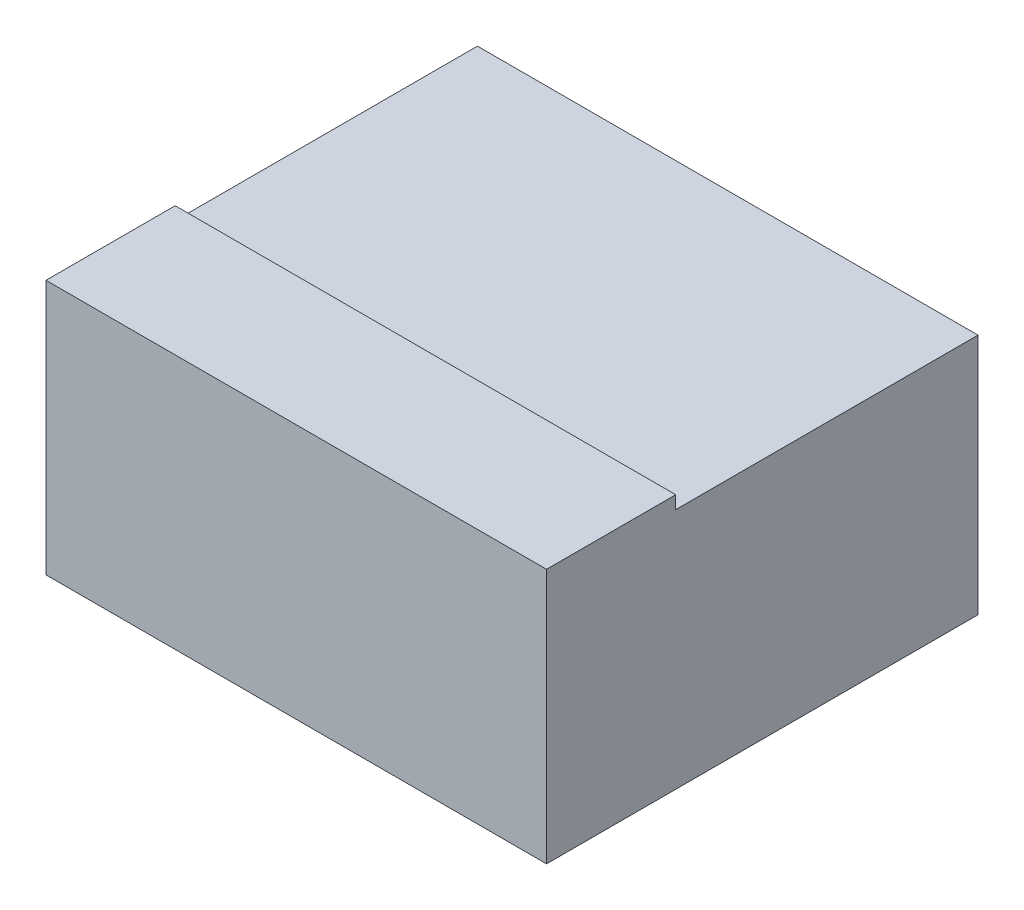
from build123d import *

# Parameters (mm, degrees)
SKETCH1_W           = 77.5
SKETCH1_H           = 66.8
BOSS_EXTRUDE1_DEPTH = 37.5
SKETCH3_W           = 77.5
SKETCH3_H           = 20
BOSS_EXTRUDE2_DEPTH = 2
SKETCH4_W           = 12
SKETCH4_H           = 12
BOSS_EXTRUDE3_DEPTH = 5


with BuildPart() as part:
    # Sketch1 → Boss-Extrude1 (new body)
    with BuildSketch(Plane(origin=(0, 0, 0), x_dir=(1, 0, 0), z_dir=(0, 1, 0))):
        Rectangle(SKETCH1_W, SKETCH1_H)
    extrude(amount=BOSS_EXTRUDE1_DEPTH)

    # Sketch3 → Boss-Extrude2 (add)
    with BuildSketch(Plane(origin=(0, 37.5, 0), x_dir=(1, 0, 0), z_dir=(0, 1, 0))):
        with Locations((0, -23.4)):
            Rectangle(SKETCH3_W, SKETCH3_H)
    extrude(amount=BOSS_EXTRUDE2_DEPTH)

    # Sketch4 → Boss-Extrude3 (add)
    with BuildSketch(Plane.ZY.offset(38.75)):
        with Locations((-27.4, 6)):
            Rectangle(SKETCH4_W, SKETCH4_H)
    extrude(amount=BOSS_EXTRUDE3_DEPTH)


solid = part.part
